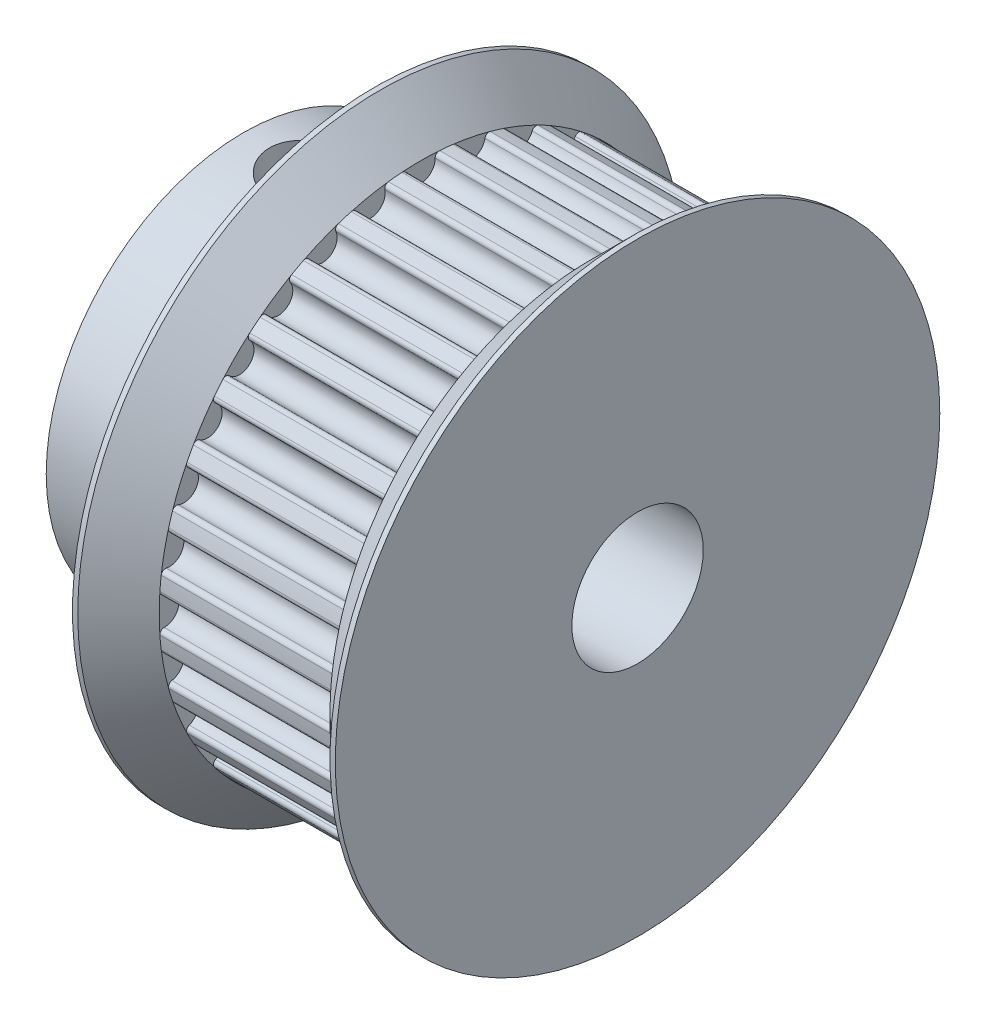
from build123d import *

# Parameters (mm, degrees)
SKETCH2_R               = 0.55
CUT_EXTRUDE1_DEPTH      = 6.5
FILLET1_R               = 0.16
SKETCH3_R               = 7.5
SKETCH3_R_2             = 2.5
BOSS_EXTRUDE1_DEPTH     = 5
CUT_EXTRUDE2_DEPTH      = 23.12464689
CUT_EXTRUDE2_DEPTH_BACK = 23.12464689
SKETCH4_R               = 1.5


with BuildPart() as part:
    # Sketch1 → Revolve1 (revolve)
    with BuildSketch(Plane(origin=(0, 0, 0), x_dir=(1, 0, 0), z_dir=(0, 1, 0))):
        Polygon((-1.75, 9.95), (-8.25, 9.95), (-9.8, 11.5), (-10, 11.5), (-10, 2.5), (0, 2.5), (0, 11.5), (-0.2, 11.5), align=None)
    revolve(axis=Axis((0, 0, 0), (-1, 0, 0)))

    # Sketch2 → Cut-Extrude1 (cut)
    with BuildSketch(Plane(origin=(-1.75, 0, 0), x_dir=(0, 0, -1), z_dir=(1, 0, 0))):
        with Locations((0, 9.75)):
            Circle(SKETCH2_R)
        with Locations((1.90213064, 9.562656484)):
            Circle(SKETCH2_R)
        with Locations((3.731163466, 9.007825442)):
            Circle(SKETCH2_R)
        with Locations((5.416809772, 8.10682872)):
            Circle(SKETCH2_R)
        with Locations((6.894291117, 6.894291117)):
            Circle(SKETCH2_R)
        with Locations((8.10682872, 5.416809772)):
            Circle(SKETCH2_R)
        with Locations((9.007825442, 3.731163466)):
            Circle(SKETCH2_R)
        with Locations((9.562656484, 1.90213064)):
            Circle(SKETCH2_R)
        with Locations((9.75, 0)):
            Circle(SKETCH2_R)
        with Locations((9.562656484, -1.90213064)):
            Circle(SKETCH2_R)
        with Locations((9.007825442, -3.731163466)):
            Circle(SKETCH2_R)
        with Locations((8.10682872, -5.416809772)):
            Circle(SKETCH2_R)
        with Locations((6.894291117, -6.894291117)):
            Circle(SKETCH2_R)
        with Locations((5.416809772, -8.10682872)):
            Circle(SKETCH2_R)
        with Locations((3.731163466, -9.007825442)):
            Circle(SKETCH2_R)
        with Locations((1.90213064, -9.562656484)):
            Circle(SKETCH2_R)
        with Locations((0, -9.75)):
            Circle(SKETCH2_R)
        with Locations((-1.90213064, -9.562656484)):
            Circle(SKETCH2_R)
        with Locations((-3.731163466, -9.007825442)):
            Circle(SKETCH2_R)
        with Locations((-5.416809772, -8.10682872)):
            Circle(SKETCH2_R)
        with Locations((-6.894291117, -6.894291117)):
            Circle(SKETCH2_R)
        with Locations((-8.10682872, -5.416809772)):
            Circle(SKETCH2_R)
        with Locations((-9.007825442, -3.731163466)):
            Circle(SKETCH2_R)
        with Locations((-9.562656484, -1.90213064)):
            Circle(SKETCH2_R)
        with Locations((-9.75, 0)):
            Circle(SKETCH2_R)
        with Locations((-9.562656484, 1.90213064)):
            Circle(SKETCH2_R)
        with Locations((-9.007825442, 3.731163466)):
            Circle(SKETCH2_R)
        with Locations((-8.10682872, 5.416809772)):
            Circle(SKETCH2_R)
        with Locations((-6.894291117, 6.894291117)):
            Circle(SKETCH2_R)
        with Locations((-5.416809772, 8.10682872)):
            Circle(SKETCH2_R)
        with Locations((-3.731163466, 9.007825442)):
            Circle(SKETCH2_R)
        with Locations((-1.90213064, 9.562656484)):
            Circle(SKETCH2_R)
    extrude(amount=-CUT_EXTRUDE1_DEPTH, mode=Mode.SUBTRACT)

    # Fillet1
    fillet1_edges = [part.edges().sort_by_distance(p)[0] for p in [
        (-5, 6.66033624, 7.392051215),
        (-5, 7.392051215, 6.66033624),
        (-5, 5.090242095, 8.549382166),
        (-5, 5.950647882, 7.974477399),
        (-5, 3.324532801, 9.378165154),
        (-5, 4.280564488, 8.982163863),
        (-5, 1.431063575, 9.846550515),
        (-5, 2.445981401, 9.644670808),
        (-5, -0.517400621, 9.936538462),
        (-5, 0.517400621, 9.936538462),
        (-5, -2.445981401, 9.644670808),
        (-5, -1.431063575, 9.846550515),
        (-5, -4.280564488, 8.982163863),
        (-5, -3.324532801, 9.378165154),
        (-5, -5.950647882, 7.974477399),
        (-5, -5.090242095, 8.549382166),
        (-5, -7.392051215, 6.66033624),
        (-5, -6.66033624, 7.392051215),
        (-5, -8.549382166, 5.090242095),
        (-5, -7.974477399, 5.950647882),
        (-5, -9.378165154, 3.324532801),
        (-5, -8.982163863, 4.280564488),
        (-5, -9.846550515, 1.431063575),
        (-5, -9.644670808, 2.445981401),
        (-5, -9.936538462, -0.517400621),
        (-5, -9.936538462, 0.517400621),
        (-5, -9.644670808, -2.445981401),
        (-5, -9.846550515, -1.431063575),
        (-5, -8.982163863, -4.280564488),
        (-5, -9.378165154, -3.324532801),
        (-5, -7.974477399, -5.950647882),
        (-5, -8.549382166, -5.090242095),
        (-5, -6.66033624, -7.392051215),
        (-5, -7.392051215, -6.66033624),
        (-5, -5.090242095, -8.549382166),
        (-5, -5.950647882, -7.974477399),
        (-5, -3.324532801, -9.378165154),
        (-5, -4.280564488, -8.982163863),
        (-5, -1.431063575, -9.846550515),
        (-5, -2.445981401, -9.644670808),
        (-5, 0.517400621, -9.936538462),
        (-5, -0.517400621, -9.936538462),
        (-5, 2.445981401, -9.644670808),
        (-5, 1.431063575, -9.846550515),
        (-5, 4.280564488, -8.982163863),
        (-5, 3.324532801, -9.378165154),
        (-5, 5.950647882, -7.974477399),
        (-5, 5.090242095, -8.549382166),
        (-5, 7.392051215, -6.66033624),
        (-5, 6.66033624, -7.392051215),
        (-5, 8.549382166, -5.090242095),
        (-5, 7.974477399, -5.950647882),
        (-5, 9.378165154, -3.324532801),
        (-5, 8.982163863, -4.280564488),
        (-5, 9.846550515, -1.431063575),
        (-5, 9.644670808, -2.445981401),
        (-5, 9.936538462, 0.517400621),
        (-5, 9.936538462, -0.517400621),
        (-5, 9.644670808, 2.445981401),
        (-5, 9.846550515, 1.431063575),
        (-5, 8.982163863, 4.280564488),
        (-5, 9.378165154, 3.324532801),
        (-5, 7.974477399, 5.950647882),
        (-5, 8.549382166, 5.090242095),
    ]]
    fillet(fillet1_edges, radius=FILLET1_R)

    # Sketch3 → Boss-Extrude1 (add)
    with BuildSketch(Plane.ZY.offset(10)):
        Circle(SKETCH3_R)
        with Locations(Location((0, 0, 0), (0, 0, 180))):
            Circle(SKETCH3_R_2, mode=Mode.SUBTRACT)
    extrude(amount=BOSS_EXTRUDE1_DEPTH)

    # Sketch4 → Cut-Extrude2 (cut, two sides: drawn at the far end of the back side and taken through both)
    with BuildSketch(Plane(origin=(0, 0, 0), x_dir=(1, 0, 0), z_dir=(0, 1, 0)).offset(-CUT_EXTRUDE2_DEPTH_BACK)):
        with Locations(Location((-12.5, 0, 0), (0, 0, 270))):
            Circle(SKETCH4_R)
    extrude(amount=CUT_EXTRUDE2_DEPTH + CUT_EXTRUDE2_DEPTH_BACK, mode=Mode.SUBTRACT)


solid = part.part
